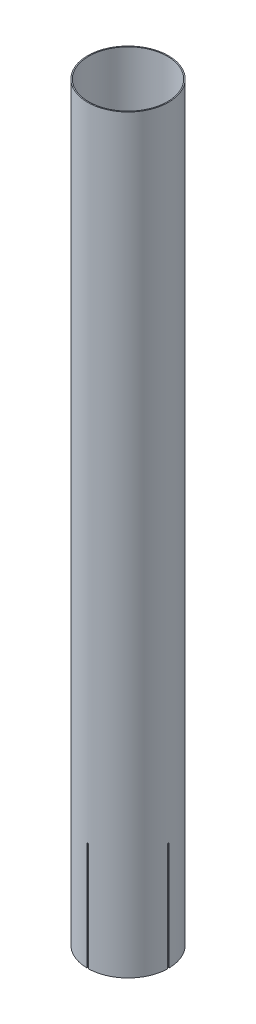
from build123d import *

# Parameters (mm, degrees)
SKETCH1_W          = 2
SKETCH1_H          = 1450
CUT_EXTRUDE1_DEPTH = 1.5
CIRPATTERN1_COUNT  = 4


with BuildPart() as part:
    # Sketch1 → Revolve1 (revolve)
    with BuildSketch(Plane.XY):
        with Locations((77.2, 725)):
            Rectangle(SKETCH1_W, SKETCH1_H)
    revolve(axis=Axis((0, 0, 0), (0, 1, 0)))

    # Sketch2 → Cut-Extrude1 (cut, symmetric)
    with BuildSketch(Plane.XY):
        Polygon((-185.2, 150), (-185.2, 0), (-78.2, 0), (0, 0), (0, 210), (-78.2, 210), align=None)
    cut_extrude1 = extrude(amount=CUT_EXTRUDE1_DEPTH, both=True, mode=Mode.SUBTRACT)

    # CirPattern1: Cut-Extrude1 ×4 about axis
    cirpattern1_axis = Axis((0, 0, 0), (0, -1, 0))
    for i in range(1, CIRPATTERN1_COUNT):
        add(cut_extrude1.rotate(cirpattern1_axis, i * 360 / CIRPATTERN1_COUNT), mode=Mode.SUBTRACT)


solid = part.part
